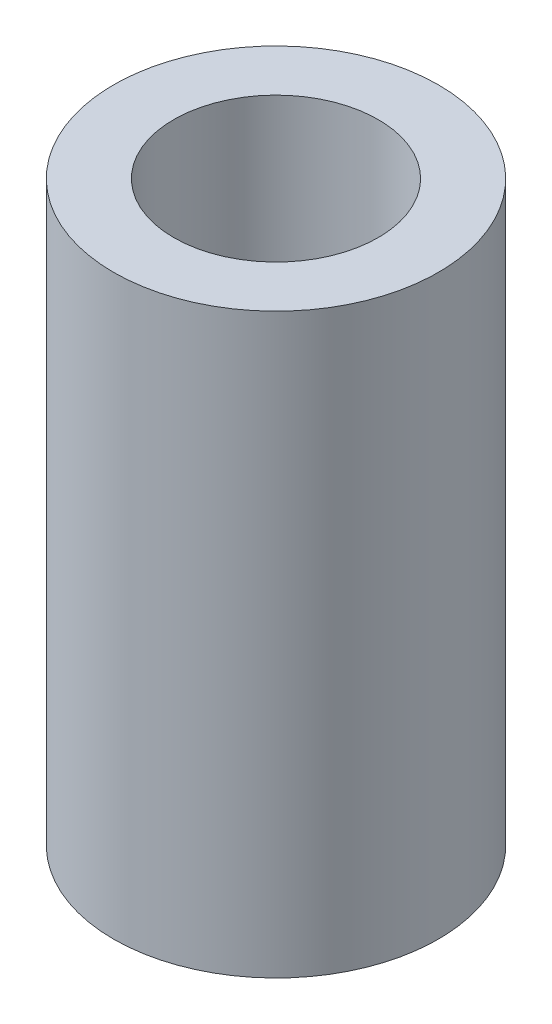
from build123d import *

# Parameters (mm, degrees)
SKETCH1_R           = 6.75
SKETCH1_R_2         = 4.25
BOSS_EXTRUDE1_DEPTH = 24


with BuildPart() as part:
    # Sketch1 → Boss-Extrude1 (new body)
    with BuildSketch(Plane(origin=(0, 0, 0), x_dir=(1, 0, 0), z_dir=(0, 1, 0))):
        with Locations(Location((0, 0, 0), (0, 0, 270))):
            Circle(SKETCH1_R)
        with Locations(Location((0, 0, 0), (0, 0, 270))):
            Circle(SKETCH1_R_2, mode=Mode.SUBTRACT)
    extrude(amount=BOSS_EXTRUDE1_DEPTH)


solid = part.part
